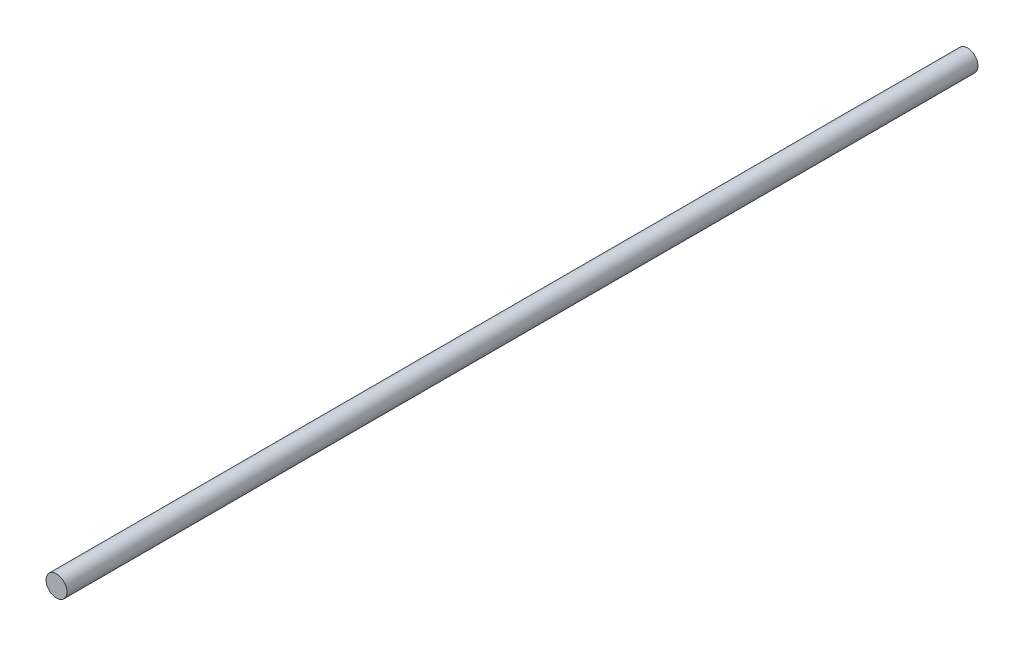
from build123d import *

# Parameters (mm, degrees)
SKETCH_1_R      = 3
EXTRUDE_1_DEPTH = 260


with BuildPart() as part:
    # 스케치1 → 보스-돌출1 (new body)
    with BuildSketch(Plane.XY):
        Circle(SKETCH_1_R)
    extrude(amount=EXTRUDE_1_DEPTH)


solid = part.part
